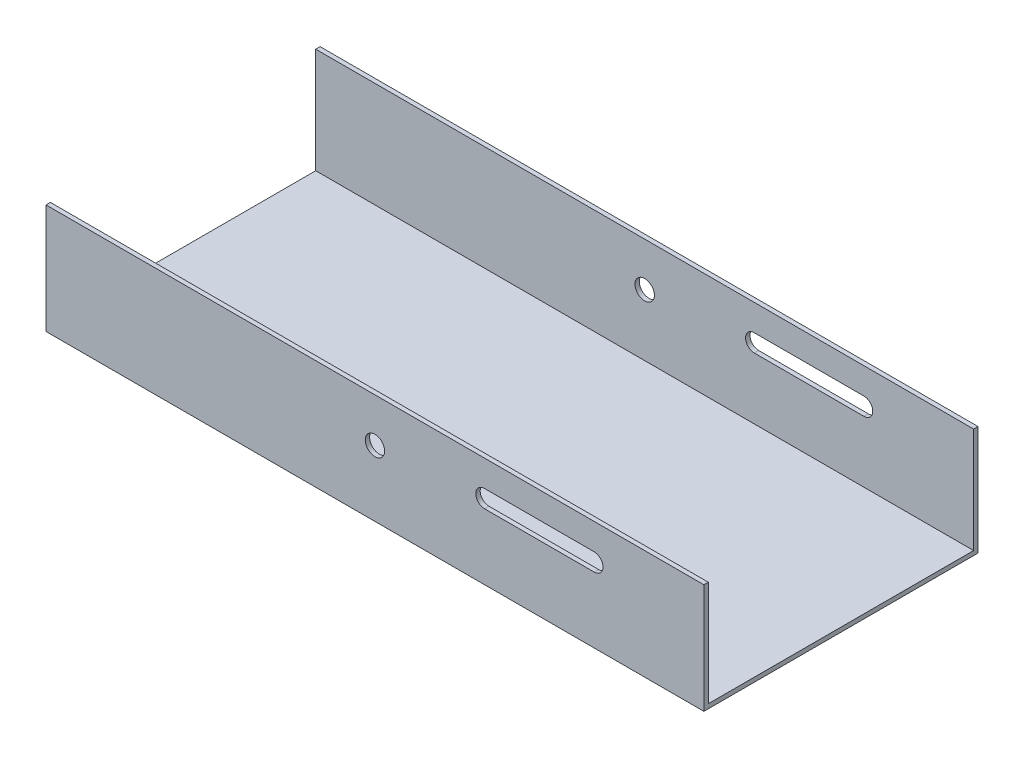
from build123d import *

# Parameters (mm, degrees)
SKETCH1_W           = 300
SKETCH1_H           = 125
BOSS_EXTRUDE1_DEPTH = 50
SHELL1_T            = -2
CUT_EXTRUDE1_DEPTH  = 142
SKETCH3_R           = 4.423757835
CUT_EXTRUDE2_DEPTH  = 132


with BuildPart() as part:
    # Sketch1 → Boss-Extrude1 (new body)
    with BuildSketch(Plane(origin=(0, 0, 0), x_dir=(1, 0, 0), z_dir=(0, 1, 0))):
        with Locations((-150, 62.5)):
            Rectangle(SKETCH1_W, SKETCH1_H)
    extrude(amount=BOSS_EXTRUDE1_DEPTH)

    # Shell1
    shell1_openings = [part.faces().sort_by_distance(p)[0] for p in [
        (-150, 50, -62.5),
        (-300, 25, -62.5),
        (0, 25, -62.5),
    ]]
    offset(amount=SHELL1_T, openings=shell1_openings, kind=Kind.INTERSECTION)

    # Sketch2 → Cut-Extrude1 (cut)
    with BuildSketch(Plane.XY):
        with BuildLine():
            Line((-100, 38), (-50, 38))
            ThreePointArc((-50, 38), (-46, 34), (-50, 30))
            Line((-50, 30), (-100, 30))
            ThreePointArc((-100, 30), (-104, 34), (-100, 38))
        make_face()
    extrude(amount=-CUT_EXTRUDE1_DEPTH, mode=Mode.SUBTRACT)

    # Sketch3 → Cut-Extrude2 (cut)
    with BuildSketch(Plane.XY):
        with Locations((-150, 30)):
            Circle(SKETCH3_R)
    extrude(amount=-CUT_EXTRUDE2_DEPTH, mode=Mode.SUBTRACT)


solid = part.part
